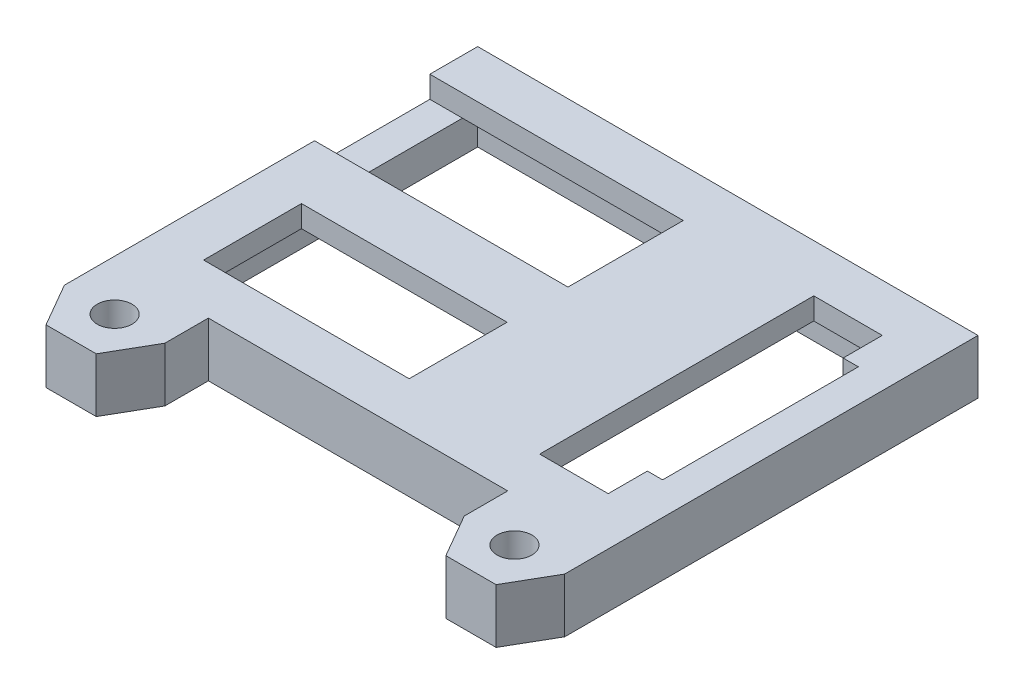
from build123d import *

# Parameters (mm, degrees)
CROQUIS1_W              = 18.9
CROQUIS1_H              = 9
SALIENTE_EXTRUIR1_DEPTH = 2
SALIENTE_EXTRUIR2_DEPTH = 3
CROQUIS3_R              = 1.6
SALIENTE_EXTRUIR4_DEPTH = 5


with BuildPart() as part:
    # Croquis1 → Saliente-Extruir1 (new body)
    with BuildSketch(Plane(origin=(0, 0, 0), x_dir=(1, 0, 0), z_dir=(0, 1, 0))):
        Polygon((23, 17), (-23, 17), (-23, 12.6), (0.3, 12.6), (0.3, 2), (-23, 2), (-23, -17), (23, -17), align=None)
        Polygon((12.3, 12.6), (18.6, 12.6), (18.6, 9), (20, 9), (20, -9), (18.6, -9), (18.6, -12.6), (12.3, -12.6), align=None, mode=Mode.SUBTRACT)
        with Locations((-9.15, -8.1)):
            Rectangle(CROQUIS1_W, CROQUIS1_H, mode=Mode.SUBTRACT)
    extrude(amount=-SALIENTE_EXTRUIR1_DEPTH)

    # Croquis2 → Saliente-Extruir2 (add)
    with BuildSketch(Plane.XZ.offset(2)):
        Polygon((-23, -17), (-23, -12.6), (-23, -2), (-23, 17), (23, 17), (23, -17), align=None)
        Polygon((-20, -14), (20, -14), (20, 14), (-20, 14), (-20, -2), (-20, -12.6), align=None, mode=Mode.SUBTRACT)
    extrude(amount=SALIENTE_EXTRUIR2_DEPTH)

    # Croquis3 → Saliente-Extruir4 (add, through all)
    # profile 1 of 6: a face of its own
    with BuildSketch(Plane(origin=(0, 0, 0), x_dir=(1, 0, 0), z_dir=(0, 1, 0))):
        Polygon((-16.07179677, -25), (-13.762395693, -21), (-16.07179677, -17), (-20.690598923, -17), (-23, -21), (-20.690598923, -25), align=None)
        with Locations(Location((-18.381197846, -21, 0), (0, 0, 270))):
            Circle(CROQUIS3_R, mode=Mode.SUBTRACT)
    # profile 2 of 6: a face of its own
    with BuildSketch(Plane(origin=(0, 0, 0), x_dir=(1, 0, 0), z_dir=(0, 1, 0))):
        Polygon((16.07179677, -25), (13.762395693, -21), (16.07179677, -17), (20.690598923, -17), (23, -21), (20.690598923, -25), align=None)
        with Locations(Location((18.381197846, -21, 0), (0, 0, 270))):
            Circle(CROQUIS3_R, mode=Mode.SUBTRACT)
    # profile 3 of 6: a face of its own
    with BuildSketch(Plane(origin=(0, 0, 0), x_dir=(1, 0, 0), z_dir=(0, 1, 0))):
        Polygon((-23, -17), (-20.690598923, -17), (-23, -21), align=None)
    # profile 4 of 6: a face of its own
    with BuildSketch(Plane(origin=(0, 0, 0), x_dir=(1, 0, 0), z_dir=(0, 1, 0))):
        Polygon((-13.762395693, -21), (-16.07179677, -17), (-13.762395693, -17), align=None)
    # profile 5 of 6: a face of its own
    with BuildSketch(Plane(origin=(0, 0, 0), x_dir=(1, 0, 0), z_dir=(0, 1, 0))):
        Polygon((13.762395693, -17), (16.07179677, -17), (13.762395693, -21), align=None)
    # profile 6 of 6: a face of its own
    with BuildSketch(Plane(origin=(0, 0, 0), x_dir=(1, 0, 0), z_dir=(0, 1, 0))):
        Polygon((20.690598923, -17), (23, -17), (23, -21), align=None)
    extrude(amount=-SALIENTE_EXTRUIR4_DEPTH)


solid = part.part
